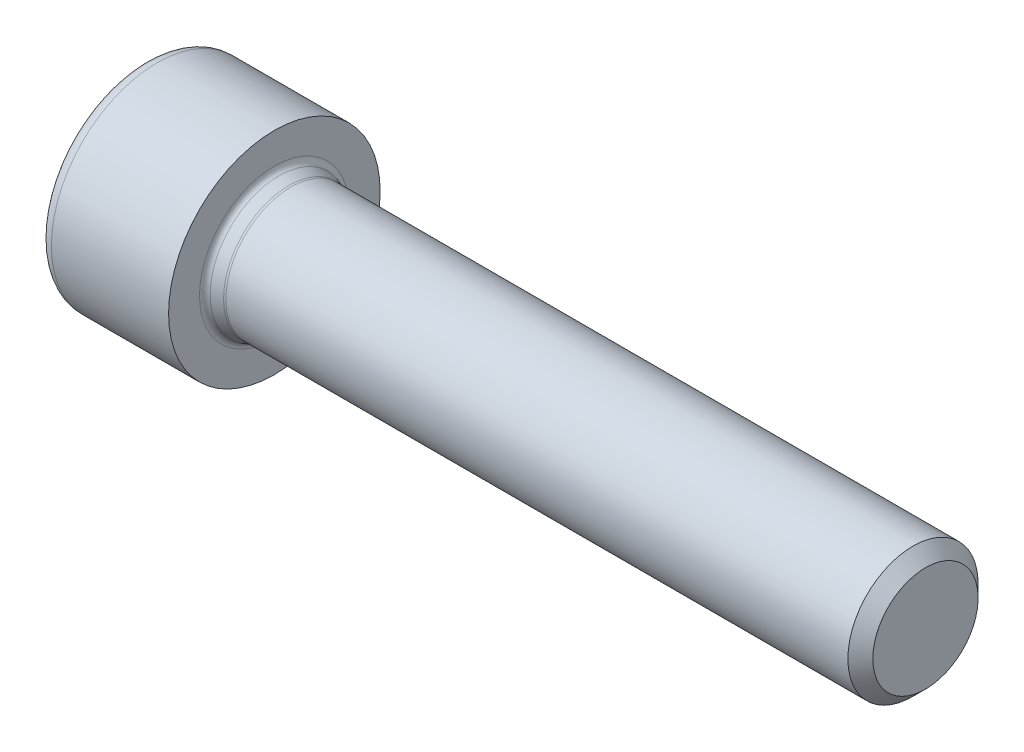
from build123d import *

# Parameters (mm, degrees)
ENL_V_MAT_EXTRU_1_DEPTH = 8
ESQUISSE3_R             = 4.875
BOSS_EXTRU_1_DEPTH      = 4.161898962


with BuildPart() as part:
    # Esquisse1 → Révolution1 (revolve)
    with BuildSketch(Plane(origin=(0, 0, 0), x_dir=(1, 0, 0), z_dir=(0, 1, 0)), mode=Mode.PRIVATE) as r_volution1_sk:
        with BuildLine():
            Line((-1.567949192, 0), (-3.3, 3))
            Line((-3.3, 3), (-7.57, 3))
            Line((-7.57, 3), (-8, 3.43))
            Line((-8, 3.43), (-8, 5.7))
            ThreePointArc((-8, 5.7), (-7.765685425, 6.265685425), (-7.2, 6.5))
            Line((-7.2, 6.5), (0, 6.5))
            Line((0, 6.5), (0, 4.6))
            ThreePointArc((0, 4.6), (0.076642269, 4.36454347), (0.277198888, 4.219316553))
            Line((0.277198888, 4.219316553), (0.897198888, 4.019316553))
            ThreePointArc((0.897198888, 4.019316553), (0.957844465, 4.004858646), (1.02, 4))
            Line((1.02, 4), (39.233, 4))
            Line((39.233, 4), (40, 3.233))
            Line((40, 3.233), (40, 0))
            Line((40, 0), (-1.567949192, 0))
        make_face()
    revolve(r_volution1_sk.sketch.rotate(Axis((43, 0, 0), (-1, 0, 0)), 180), axis=Axis((43, 0, 0), (-1, 0, 0)))

    # Esquisse2 → Enlèv. mat.-Extru.1 (cut)
    with BuildSketch(Plane(origin=(-3.3, 0, 0), x_dir=(0, 0, -1), z_dir=(1, 0, 0))):
        Polygon((-3, 1.732050808), (-3, -1.732050808), (0, -3.464101615), (3, -1.732050808), (3, 1.732050808), (0, 3.464101615), align=None)
    extrude(amount=-ENL_V_MAT_EXTRU_1_DEPTH, mode=Mode.SUBTRACT)


with BuildPart() as body_2:
    # Esquisse3 → Boss.-Extru.1 (new body)
    with BuildSketch(Plane(origin=(0, 0, 0), x_dir=(0, 0, -1), z_dir=(1, 0, 0))):
        Circle(ESQUISSE3_R)
    extrude(amount=-BOSS_EXTRU_1_DEPTH)

    # SupprimerFace1: 1 face struck out; the rest of the skin is kept as a surface, the solid goes
    supprimerface1_1_drop = [body_2.part.faces().sort_by_distance(Vector(p))[0] for p in ((-4.161898962, 0, 0),)]
    supprimerface1_1 = Shell(body_2.part.faces() - supprimerface1_1_drop)


solid = part.part
